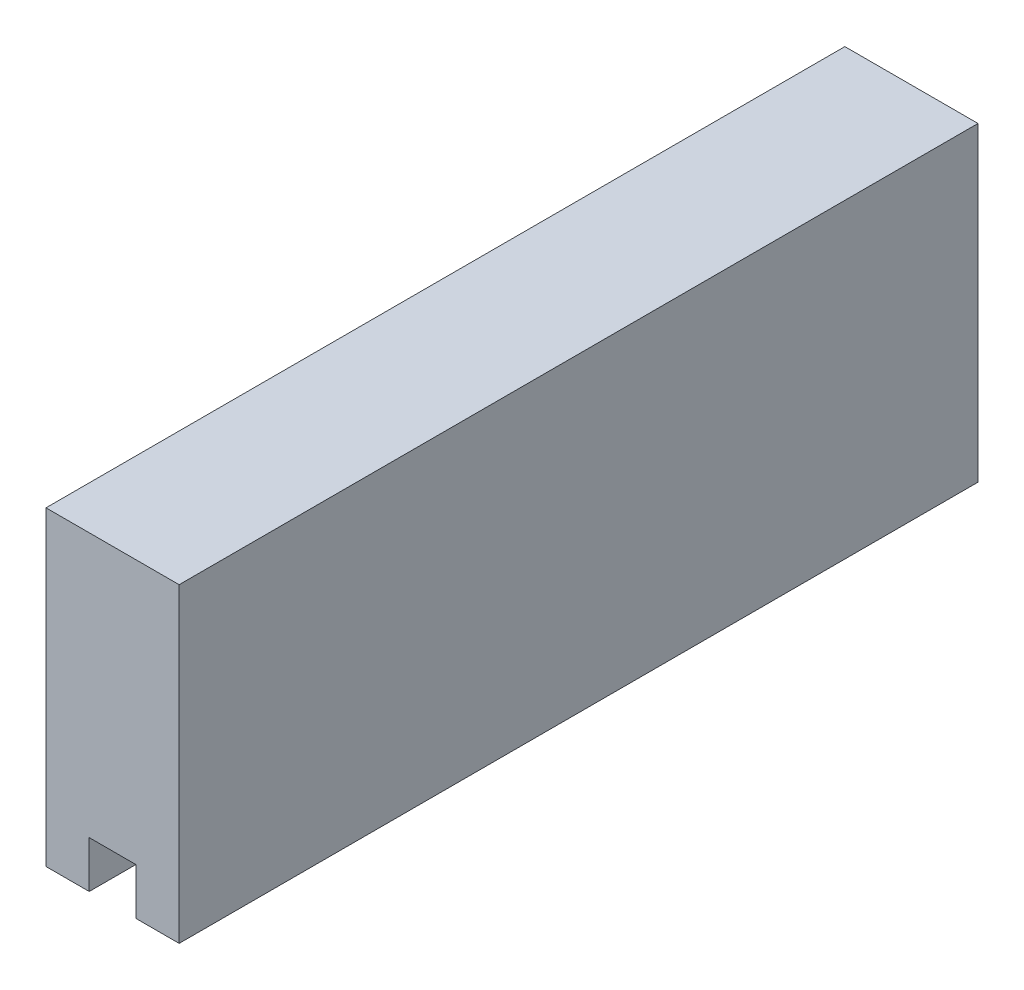
from build123d import *

# Parameters (mm, degrees)
MAINBODY_EXTRUDE_START = -90
PROJECTIONXY_SKETCH_W  = 30
PROJECTIONXY_SKETCH_H  = 70
MAINBODY_EXTRUDE_DEPTH = 180
TROUGH_CUT_DEPTH       = 98.724101428
TROUGH_CUT_DEPTH_BACK  = 98.724101428
TROUGH_SKETCH_W        = 10.514570696
TROUGH_SKETCH_H        = 10.514570696


with BuildPart() as part:
    # projectionXy_sketch → mainBody_extrude (new body)
    with BuildSketch(Plane.XY.offset(MAINBODY_EXTRUDE_START)):
        Rectangle(PROJECTIONXY_SKETCH_W, PROJECTIONXY_SKETCH_H)
    extrude(amount=MAINBODY_EXTRUDE_DEPTH)

    # trough_sketch → trough_cut (cut, two sides: drawn at the far end of the back side and taken through both)
    with BuildSketch(Plane(origin=(0, 0, 0), x_dir=(1, 0, 0), z_dir=(0, 0, -1)).offset(-TROUGH_CUT_DEPTH_BACK)):
        with Locations((0, 29.742714652)):
            Rectangle(TROUGH_SKETCH_W, TROUGH_SKETCH_H)
    extrude(amount=TROUGH_CUT_DEPTH + TROUGH_CUT_DEPTH_BACK, mode=Mode.SUBTRACT)


solid = part.part
